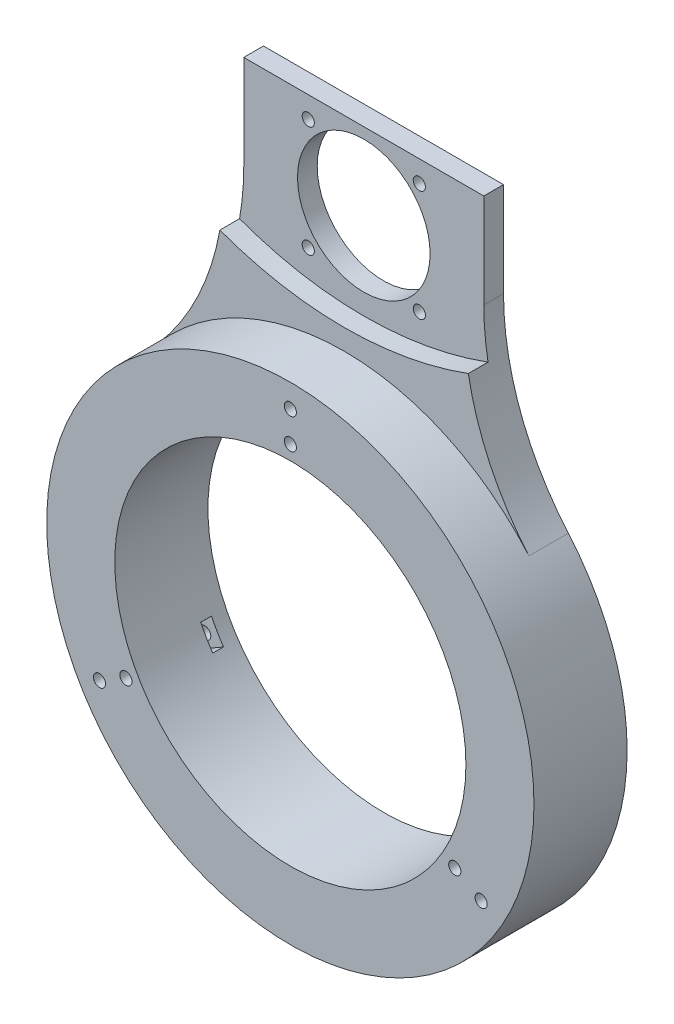
from build123d import *

# Parameters (mm, degrees)
BOSS_EXTRUDE1_DEPTH      = 15
BOSS_EXTRUDE1_DEPTH_BACK = 11
SKETCH1_R                = 68
SKETCH1_R_2              = 49
SKETCH2_W                = 43
SKETCH2_H                = 43
SKETCH2_R                = 18.5
BOSS_EXTRUDE2_DEPTH      = 11
SKETCH3_R                = 1.7
CUT_EXTRUDE1_DEPTH       = 140.929446508
SKETCH4_R                = 100
CUT_EXTRUDE2_DEPTH       = 5.5
SKETCH5_R                = 1.7
CUT_EXTRUDE3_DEPTH       = 140.929446508
SKETCH6_R                = 2.95
CUT_EXTRUDE4_DEPTH       = 3
CIRPATTERN1_COUNT        = 3
CUT_EXTRUDE5_DEPTH       = 3
CIRPATTERN2_COUNT        = 3


with BuildPart() as part:
    # Sketch1 → Boss-Extrude1 (new, two sides: drawn at the far end of the back side and taken through both)
    with BuildSketch(Plane.XY.offset(-BOSS_EXTRUDE1_DEPTH_BACK)):
        Circle(SKETCH1_R)
        Circle(SKETCH1_R_2, mode=Mode.SUBTRACT)
    extrude(amount=BOSS_EXTRUDE1_DEPTH + BOSS_EXTRUDE1_DEPTH_BACK)

    # Sketch2 → Boss-Extrude2 (add)
    # profile 1 of 6: a face of its own
    with BuildSketch(Plane(origin=(0, 0, -11), x_dir=(-1, 0, 0), z_dir=(0, 0, -1))):
        with BuildLine():
            Line((-33.5, 66.5), (-33.5, 93.149074069))
            ThreePointArc((-33.5, 93.149074069), (-38.168927278, 67.100269686), (-51.594405594, 44.294664592))
            ThreePointArc((-51.594405594, 44.294664592), (-34.722076366, 58.466891596), (-14.203872711, 66.5))
            Line((-14.203872711, 66.5), (-33.5, 66.5))
        make_face()
    # profile 2 of 6: a face of its own
    with BuildSketch(Plane(origin=(0, 0, -11), x_dir=(-1, 0, 0), z_dir=(0, 0, -1))):
        with BuildLine():
            ThreePointArc((-14.203872711, 66.5), (-34.722076366, 58.466891596), (-51.594405594, 44.294664592))
            Line((-51.594405594, 44.294664592), (-20.951913723, 44.294664592))
            ThreePointArc((-20.951913723, 44.294664592), (0, 49), (20.951913723, 44.294664592))
            Line((20.951913723, 44.294664592), (51.594405594, 44.294664592))
            ThreePointArc((51.594405594, 44.294664592), (34.722076366, 58.466891596), (14.203872711, 66.5))
            Line((14.203872711, 66.5), (-14.203872711, 66.5))
        make_face()
    # profile 3 of 6: a face of its own
    with BuildSketch(Plane(origin=(0, 0, -11), x_dir=(-1, 0, 0), z_dir=(0, 0, -1))):
        with BuildLine():
            ThreePointArc((51.594405594, 44.294664592), (38.168927278, 67.100269686), (33.5, 93.149074069))
            Line((33.5, 93.149074069), (33.5, 66.5))
            Line((33.5, 66.5), (14.203872711, 66.5))
            ThreePointArc((14.203872711, 66.5), (34.722076366, 58.466891596), (51.594405594, 44.294664592))
        make_face()
    # profile 4 of 6: a face of its own
    with BuildSketch(Plane(origin=(0, 0, -11), x_dir=(-1, 0, 0), z_dir=(0, 0, -1))):
        with BuildLine():
            ThreePointArc((14.203872711, 66.5), (0, 68), (-14.203872711, 66.5))
            Line((-14.203872711, 66.5), (14.203872711, 66.5))
        make_face()
    # profile 5 of 6: a face of its own
    with BuildSketch(Plane(origin=(0, 0, -11), x_dir=(-1, 0, 0), z_dir=(0, 0, -1))):
        with BuildLine():
            Line((-21.5, 76.5), (-21.5, 119.5))
            Line((-21.5, 119.5), (-33.5, 119.5))
            Line((-33.5, 119.5), (-33.5, 93.149074069))
            Line((-33.5, 93.149074069), (-33.5, 66.5))
            Line((-33.5, 66.5), (-14.203872711, 66.5))
            ThreePointArc((-14.203872711, 66.5), (0, 68), (14.203872711, 66.5))
            Line((14.203872711, 66.5), (33.5, 66.5))
            Line((33.5, 66.5), (33.5, 93.149074069))
            Line((33.5, 93.149074069), (33.5, 119.5))
            Line((33.5, 119.5), (21.5, 119.5))
            Line((21.5, 119.5), (21.5, 76.5))
            Line((21.5, 76.5), (-21.5, 76.5))
        make_face()
    # profile 6 of 6: a face of its own
    with BuildSketch(Plane(origin=(0, 0, -11), x_dir=(-1, 0, 0), z_dir=(0, 0, -1))):
        with Locations((0, 98)):
            Rectangle(SKETCH2_W, SKETCH2_H)
        with Locations((0, 98)):
            Circle(SKETCH2_R, mode=Mode.SUBTRACT)
    extrude(amount=-BOSS_EXTRUDE2_DEPTH)

    # Sketch3 → Cut-Extrude1 (cut, through all)
    with BuildSketch(Plane(origin=(0, 0, -11), x_dir=(-1, 0, 0), z_dir=(0, 0, -1))):
        with Locations((-15.5, 113.5)):
            Circle(SKETCH3_R)
        with Locations((15.5, 113.5)):
            Circle(SKETCH3_R)
        with Locations((15.5, 82.5)):
            Circle(SKETCH3_R)
        with Locations((-15.5, 82.5)):
            Circle(SKETCH3_R)
    extrude(amount=-CUT_EXTRUDE1_DEPTH, mode=Mode.SUBTRACT)

    # Sketch4 → Cut-Extrude2 (cut)
    with BuildSketch(Plane.XY):
        with Locations((0, 173.721812761)):
            Circle(SKETCH4_R)
    extrude(amount=-CUT_EXTRUDE2_DEPTH, mode=Mode.SUBTRACT)

    # Sketch5 → Cut-Extrude3 (cut, through all)
    with BuildSketch(Plane(origin=(0, 0, -11), x_dir=(-1, 0, 0), z_dir=(0, 0, -1))):
        with Locations((0, 61.5)):
            Circle(SKETCH5_R)
        with Locations((53.260562333, -30.75)):
            Circle(SKETCH5_R)
        with Locations((-53.260562333, -30.75)):
            Circle(SKETCH5_R)
        with Locations((0, 53)):
            Circle(SKETCH5_R)
        with Locations((45.899346401, -26.5)):
            Circle(SKETCH5_R)
        with Locations((-45.899346401, -26.5)):
            Circle(SKETCH5_R)
    extrude(amount=-CUT_EXTRUDE3_DEPTH, mode=Mode.SUBTRACT)

    # Sketch6 → Cut-Extrude4 (cut)
    with BuildSketch(Plane(origin=(0, 0, -11), x_dir=(-1, 0, 0), z_dir=(0, 0, -1))):
        with Locations((0, 61.5)):
            Circle(SKETCH6_R)
    cut_extrude4 = extrude(amount=-CUT_EXTRUDE4_DEPTH, mode=Mode.SUBTRACT)

    # CirPattern1: Cut-Extrude4 ×3 about axis
    cirpattern1_axis = Axis((0, 0, 0), (0, 0, 1))
    for i in range(1, CIRPATTERN1_COUNT):
        add(cut_extrude4.rotate(cirpattern1_axis, i * 360 / CIRPATTERN1_COUNT), mode=Mode.SUBTRACT)

    # Sketch7 → Cut-Extrude5 (cut)
    with BuildSketch(Plane(origin=(0, 0, -7), x_dir=(-1, 0, 0), z_dir=(0, 0, -1))):
        Polygon((-3.35, 44), (3.35, 44), (3.35, 53), (1.675, 50.098814897), (-1.675, 50.098814897), (-3.35, 53), align=None)
        Polygon((1.675, 50.098814897), (-1.675, 50.098814897), (-3.35, 53), (-1.675, 55.901185103), (1.675, 55.901185103), (3.35, 53), align=None)
    cut_extrude5 = extrude(amount=-CUT_EXTRUDE5_DEPTH, mode=Mode.SUBTRACT)

    # CirPattern2: Cut-Extrude5 ×3 about axis
    cirpattern2_axis = Axis((0, 0, 0), (0, 0, 1))
    for i in range(1, CIRPATTERN2_COUNT):
        add(cut_extrude5.rotate(cirpattern2_axis, i * 360 / CIRPATTERN2_COUNT), mode=Mode.SUBTRACT)


solid = part.part
